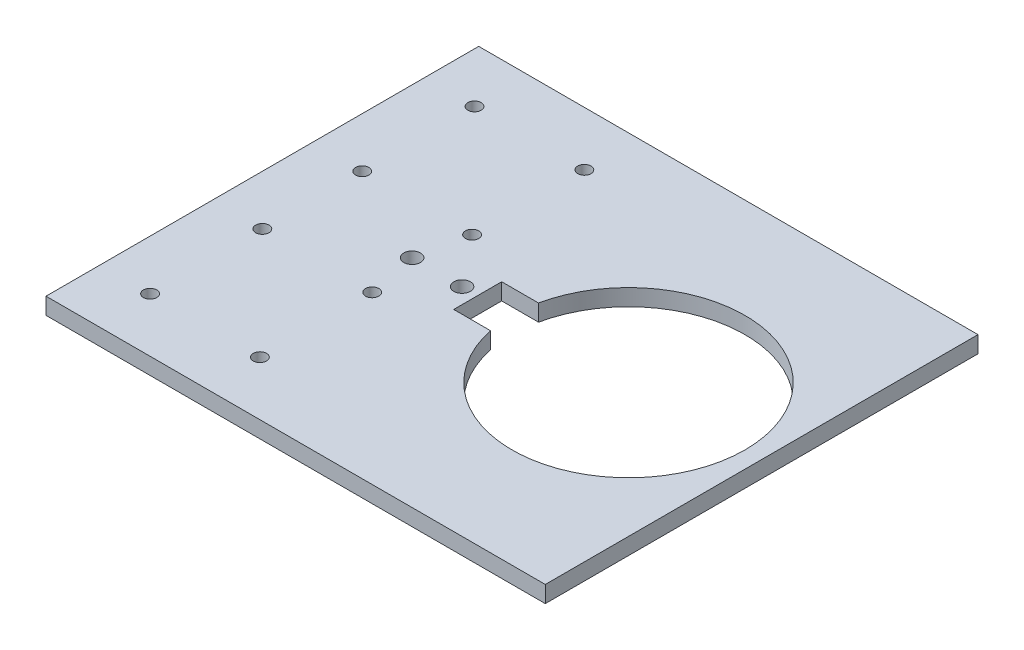
from build123d import *

# Parameters (mm, degrees)
SKETCH1_W           = 150
SKETCH1_H           = 130
SKETCH1_R           = 2.500000001
SKETCH1_R_2         = 2
BOSS_EXTRUDE1_DEPTH = 5


with BuildPart() as part:
    # Sketch1 → Boss-Extrude1 (new body)
    with BuildSketch(Plane(origin=(0, 0, 0), x_dir=(1, 0, 0), z_dir=(0, 1, 0))):
        Rectangle(SKETCH1_W, SKETCH1_H)
        with Locations(Location((-15.000000001, 0, 0), (0, 0, 270))):
            Circle(SKETCH1_R, mode=Mode.SUBTRACT)
        with Locations(Location((-30.000000001, 0, 0), (0, 0, 270))):
            Circle(SKETCH1_R, mode=Mode.SUBTRACT)
        with Locations(Location((-60, -15, 0), (0, 0, 270))):
            Circle(SKETCH1_R_2, mode=Mode.SUBTRACT)
        with Locations(Location((-60, -48.737765205, 0), (0, 0, 270))):
            Circle(SKETCH1_R_2, mode=Mode.SUBTRACT)
        with Locations(Location((-27, -48.737765205, 0), (0, 0, 270))):
            Circle(SKETCH1_R_2, mode=Mode.SUBTRACT)
        with Locations(Location((-27, -15, 0), (0, 0, 270))):
            Circle(SKETCH1_R_2, mode=Mode.SUBTRACT)
        with Locations(Location((-27, 15, 0), (0, 0, 270))):
            Circle(SKETCH1_R_2, mode=Mode.SUBTRACT)
        with Locations(Location((-60, 15, 0), (0, 0, 270))):
            Circle(SKETCH1_R_2, mode=Mode.SUBTRACT)
        with Locations(Location((-60, 48.737765205, 0), (0, 0, 270))):
            Circle(SKETCH1_R_2, mode=Mode.SUBTRACT)
        with Locations(Location((-27, 48.737765205, 0), (0, 0, 270))):
            Circle(SKETCH1_R_2, mode=Mode.SUBTRACT)
        with BuildLine():
            Line((0.750570036, -7.209476205), (-10.305683507, -7.209476205))
            Line((-10.305683507, -7.209476205), (-10.305683507, 7.209476205))
            Line((-10.305683507, 7.209476205), (0.750570036, 7.209476205))
            ThreePointArc((0.750570036, 7.209476205), (70, 0), (0.750570036, -7.209476205))
        make_face(mode=Mode.SUBTRACT)
    extrude(amount=BOSS_EXTRUDE1_DEPTH)


solid = part.part
